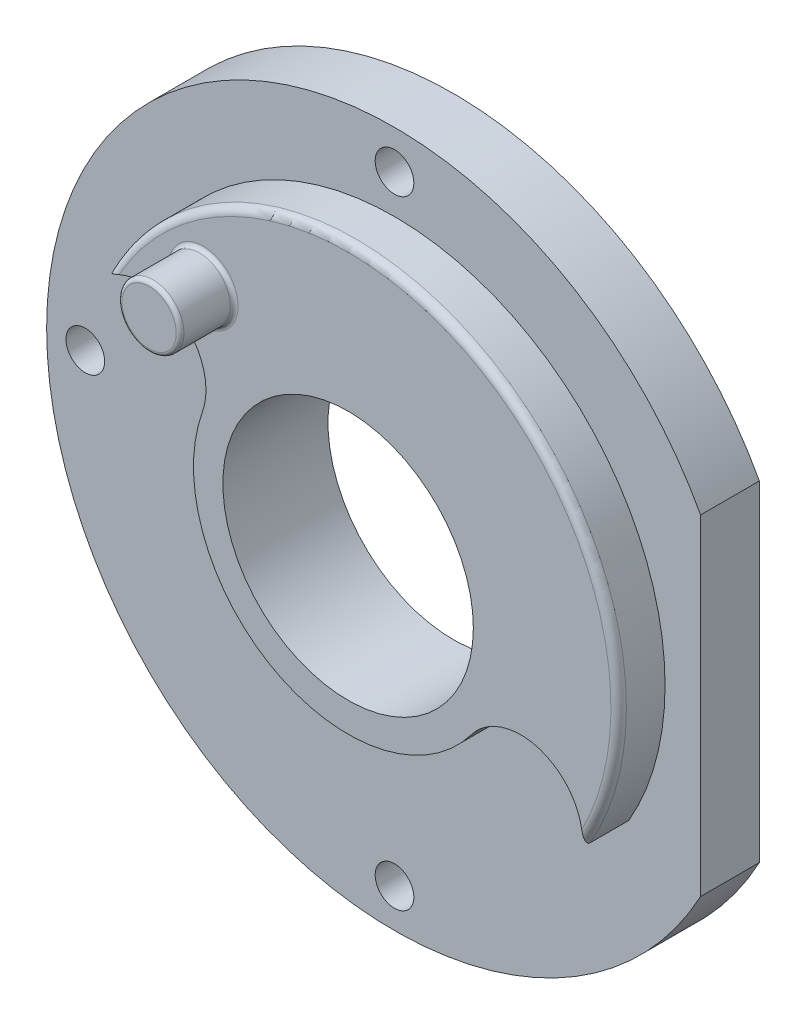
from build123d import *

# Parameters (mm, degrees)
SKETCH_1_R          = 22.5
SKETCH_1_R_2        = 1.25
EXTRUDE_1_DEPTH     = 3.8
SKETCH_2_R          = 17.5
EXTRUDE_2_DEPTH     = 3
SKETCH_3_R          = 2
EXTRUDE_3_DEPTH     = 3.5
FILLET_1_R          = 0.5
FILLET_2_R          = 0.25
CUT_EXTRUDE_1_DEPTH = 3
SKETCH_5_R          = 8.1
CUT_EXTRUDE_2_DEPTH = 11
SKETCH_6_W          = 10.283159463
SKETCH_6_H          = 33.988548121
CUT_EXTRUDE_3_DEPTH = 17


with BuildPart() as part:
    # 草图1 → 凸台-拉伸1 (new body)
    with BuildSketch(Plane.XY):
        with Locations(Location((0, 0, 0), (0, 0, 180))):
            Circle(SKETCH_1_R)
        with Locations(Location((0, 20, 0), (0, 0, 180))):
            Circle(SKETCH_1_R_2, mode=Mode.SUBTRACT)
        with Locations(Location((0, -20, 0), (0, 0, 180))):
            Circle(SKETCH_1_R_2, mode=Mode.SUBTRACT)
        with Locations(Location((-20, 0, 0), (0, 0, 180))):
            Circle(SKETCH_1_R_2, mode=Mode.SUBTRACT)
    extrude(amount=EXTRUDE_1_DEPTH)

    # 草图2 → 凸台-拉伸2 (add)
    with BuildSketch(Plane.XY.offset(3.8)):
        Circle(SKETCH_2_R)
    extrude(amount=EXTRUDE_2_DEPTH)

    # 草图3 → 凸台-拉伸3 (add)
    with BuildSketch(Plane.XY.offset(6.8)):
        with Locations((-9.367828489, 10.404027557)):
            Circle(SKETCH_3_R)
    extrude(amount=EXTRUDE_3_DEPTH)

    # 圆角1
    fillet_1_edges = [part.edges().sort_by_distance(p)[0] for p in [
        (-17.5, 0, 6.8),
    ]]
    fillet(fillet_1_edges, radius=FILLET_1_R)

    # 圆角2
    fillet_2_edges = [part.edges().sort_by_distance(p)[0] for p in [
        (-11.367828489, 10.404027557, 6.8),
        (-11.367828489, 10.404027557, 10.3),
    ]]
    fillet(fillet_2_edges, radius=FILLET_2_R)

    # 草图4 → 切除-拉伸1 (cut)
    with BuildSketch(Plane.XY.offset(6.8)):
        with BuildLine():
            ThreePointArc((-16.962482908, 6.022804462), (-8.539705078, -15.845297005), (14.357267915, -10.856742514))
            ThreePointArc((14.357267915, -10.856742514), (13.579373382, -5.253629085), (7.976259953, -6.031523619))
            ThreePointArc((7.976259953, -6.031523619), (-4.744280599, -8.802942781), (-9.423601616, 3.346002479))
            ThreePointArc((-9.423601616, 3.346002479), (-11.85464127, 8.453844117), (-16.962482908, 6.022804462))
        make_face()
    extrude(amount=-CUT_EXTRUDE_1_DEPTH, mode=Mode.SUBTRACT)

    # 草图5 → 切除-拉伸2 (cut)
    with BuildSketch(Plane.XY.offset(6.8)):
        Circle(SKETCH_5_R)
    extrude(amount=-CUT_EXTRUDE_2_DEPTH, mode=Mode.SUBTRACT)

    # 草图6 → 切除-拉伸3 (cut)
    with BuildSketch(Plane.XY.offset(3.8)):
        with Locations((24.941579731, -0.947133109)):
            Rectangle(SKETCH_6_W, SKETCH_6_H)
    extrude(amount=-CUT_EXTRUDE_3_DEPTH, mode=Mode.SUBTRACT)


solid = part.part
